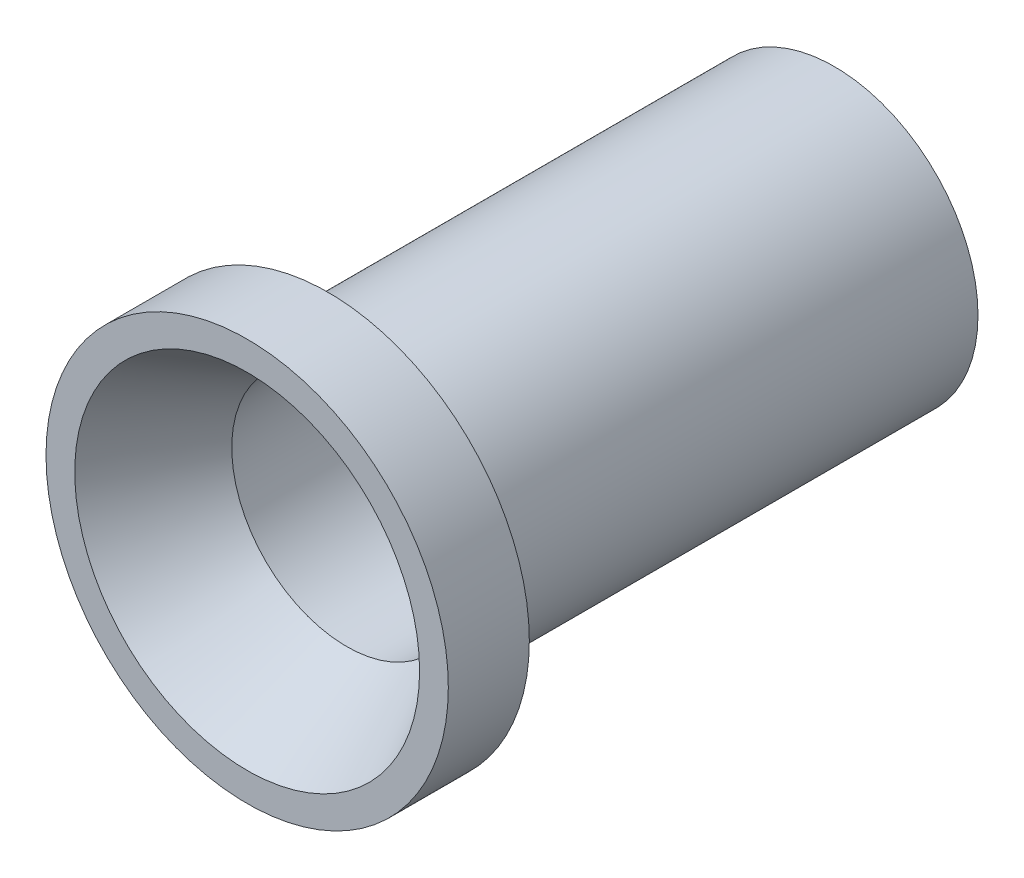
from build123d import *


with BuildPart() as part:
    # Sketch1 → Revolve1 (revolve)
    with BuildSketch(Plane(origin=(0, 0, 0), x_dir=(0, 0, -1), z_dir=(1, 0, 0)), mode=Mode.PRIVATE) as revolve1_sk:
        Polygon((16.49741665, 25), (100, 25), (100, 20), (15.162737803, 20), (-2.157770273, 30), (-2.157770273, 35), (11.936524094, 35), (11.936524094, 27.633232545), align=None)
    revolve(revolve1_sk.sketch.rotate(Axis((0, 0, 0), (0, 0, -1)), 90), axis=Axis((0, 0, 0), (0, 0, -1)))


solid = part.part
